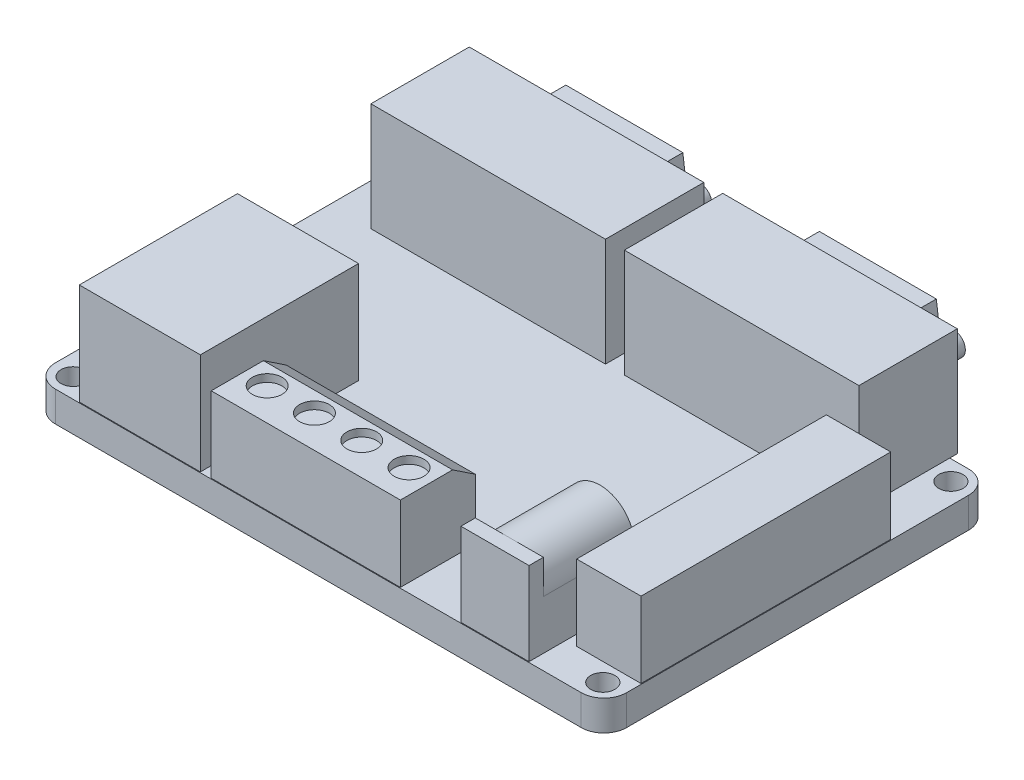
from build123d import *

# Parameters (mm, degrees)
SKETCH_1_W          = 75.5
SKETCH_1_H          = 51.2
EXTRUDE_1_DEPTH     = 4
HOLE_WIZARD_M3_1_D  = 3.2
FILLET_1_R          = 3
SKETCH_4_W          = 9
SKETCH_4_H          = 11
EXTRUDE_2_DEPTH     = 14
CUT_EXTRUDE_1_DEPTH = 12
SKETCH_6_W          = 25
SKETCH_6_H          = 10
EXTRUDE_3_DEPTH     = 10
SKETCH_7_R          = 1.963016799
CUT_EXTRUDE_2_DEPTH = 1
CHAMFER_1_SIZE      = 2
CHAMFER_1_SIZE2     = 3
SKETCH_8_W          = 8.6
SKETCH_8_H          = 33
EXTRUDE_4_DEPTH     = 10
SKETCH_9_W          = 31
SKETCH_9_H          = 18
EXTRUDE_5_DEPTH     = 14.3
SKETCH_10_W         = 31
SKETCH_10_H         = 14.3
SKETCH_10_R         = 1.542197262
CUT_EXTRUDE_3_DEPTH = 5
SKETCH_11_W         = 16
SKETCH_11_H         = 21
EXTRUDE_6_DEPTH     = 13.4
SKETCH_12_W         = 59.433168898
SKETCH_12_H         = 13.4
CUT_EXTRUDE_4_DEPTH = 0.1
SKETCH_13_W         = 33
SKETCH_13_H         = 10
CUT_EXTRUDE_5_DEPTH = 0.1


with BuildPart() as part:
    # 草图1 → 凸台-拉伸1 (new body)
    with BuildSketch(Plane(origin=(0, 0, 0), x_dir=(1, 0, 0), z_dir=(0, 1, 0))):
        Rectangle(SKETCH_1_W, SKETCH_1_H)
    extrude(amount=EXTRUDE_1_DEPTH)

    # M3 间隙孔1 (through all)
    with Locations(Plane(origin=(0, 4, 0), x_dir=(1, 0, 0), z_dir=(0, 1, 0))):
        with Locations((-35, 23), (35, 23), (-35, -23), (35, -23)):
            Hole(HOLE_WIZARD_M3_1_D / 2)

    # 圆角1
    fillet_1_edges = [part.edges().sort_by_distance(p)[0] for p in [
        (-37.75, 2, -25.6),
        (37.75, 2, -25.6),
        (37.75, 2, 25.6),
        (-37.75, 2, 25.6),
    ]]
    fillet(fillet_1_edges, radius=FILLET_1_R)

    # 草图4 → 凸台-拉伸2 (add)
    with BuildSketch(Plane.XY.offset(25.6)):
        with Locations((23.25, 9.5)):
            Rectangle(SKETCH_4_W, SKETCH_4_H)
    extrude(amount=-EXTRUDE_2_DEPTH)

    # 草图5 → 切除-拉伸1 (cut)
    with BuildSketch(Plane(origin=(0, 0, 11.6), x_dir=(-1, 0, 0), z_dir=(0, 0, -1))):
        with BuildLine():
            Line((-27.75, 10.5), (-28.75, 10.5))
            Line((-28.75, 10.5), (-28.75, 16))
            Line((-28.75, 16), (-17.75, 16))
            Line((-17.75, 16), (-17.75, 10.5))
            Line((-17.75, 10.5), (-18.75, 10.5))
            ThreePointArc((-18.75, 10.5), (-23.25, 15), (-27.75, 10.5))
        make_face()
    extrude(amount=-CUT_EXTRUDE_1_DEPTH, mode=Mode.SUBTRACT)

    # 草图6 → 凸台-拉伸3 (add)
    with BuildSketch(Plane(origin=(0, 4, 0), x_dir=(1, 0, 0), z_dir=(0, 1, 0))):
        with Locations((-1.75, -20.6)):
            Rectangle(SKETCH_6_W, SKETCH_6_H)
    extrude(amount=EXTRUDE_3_DEPTH)

    # 草图7 → 切除-拉伸2 (cut)
    with BuildSketch(Plane(origin=(0, 14, 0), x_dir=(1, 0, 0), z_dir=(0, 1, 0))):
        with Locations(Location((-11.125, -21.230534839, 0), (0, 0, 270))):
            Circle(SKETCH_7_R)
        with Locations(Location((-4.875, -21.230534839, 0), (0, 0, 90))):
            Circle(SKETCH_7_R)
        with Locations(Location((7.625, -21.230534839, 0), (0, 0, 90))):
            Circle(SKETCH_7_R)
        with Locations(Location((1.375, -21.230534839, 0), (0, 0, 270))):
            Circle(SKETCH_7_R)
    extrude(amount=-CUT_EXTRUDE_2_DEPTH, mode=Mode.SUBTRACT)

    # 倒角1
    chamfer_1_edges = [part.edges().sort_by_distance(p)[0] for p in [
        (-1.75, 14, 15.6),
    ]]
    chamfer_1_side = [part.faces().sort_by_distance(p)[0] for p in [
        (-1.75, 9, 15.6),
    ]]
    chamfer(chamfer_1_edges, length=CHAMFER_1_SIZE, length2=CHAMFER_1_SIZE2, reference=chamfer_1_side[0])

    # 草图8 → 凸台-拉伸4 (add)
    with BuildSketch(Plane(origin=(0, 4, 0), x_dir=(1, 0, 0), z_dir=(0, 1, 0))):
        with Locations((33.45, -4.1)):
            Rectangle(SKETCH_8_W, SKETCH_8_H)
    extrude(amount=EXTRUDE_4_DEPTH)

    # 草图9 → 凸台-拉伸5 (add)
    with BuildSketch(Plane(origin=(0, 4, 0), x_dir=(1, 0, 0), z_dir=(0, 1, 0))):
        with Locations((-16.75, 22.6)):
            Rectangle(SKETCH_9_W, SKETCH_9_H)
        with Locations((16.75, 22.6)):
            Rectangle(SKETCH_9_W, SKETCH_9_H)
    extrude(amount=EXTRUDE_5_DEPTH)

    # 草图10 → 切除-拉伸3 (cut)
    # profile 1 of 2: a face of its own
    with BuildSketch(Plane(origin=(0, 0, -31.6), x_dir=(-1, 0, 0), z_dir=(0, 0, -1))):
        with Locations((-16.75, 11.15)):
            Rectangle(SKETCH_10_W, SKETCH_10_H)
        with Locations((-26.769914648, 11.409080509)):
            Circle(SKETCH_10_R, mode=Mode.SUBTRACT)
        with Locations((-6.730085352, 11.409080509)):
            Circle(SKETCH_10_R, mode=Mode.SUBTRACT)
        Polygon((-25.404607637, 8.177619476), (-8.095392363, 8.177619476), (-9.020301502, 15.325154661), (-24.479698498, 15.325154661), align=None, mode=Mode.SUBTRACT)
    # profile 2 of 2: a face of its own
    with BuildSketch(Plane(origin=(0, 0, -31.6), x_dir=(-1, 0, 0), z_dir=(0, 0, -1))):
        with Locations((16.75, 11.15)):
            Rectangle(SKETCH_10_W, SKETCH_10_H)
        with Locations((6.730085352, 11.409080509)):
            Circle(SKETCH_10_R, mode=Mode.SUBTRACT)
        with Locations((26.769914648, 11.409080509)):
            Circle(SKETCH_10_R, mode=Mode.SUBTRACT)
        Polygon((9.020301502, 15.325154661), (8.095392363, 8.177619476), (25.404607637, 8.177619476), (24.479698498, 15.325154661), align=None, mode=Mode.SUBTRACT)
    extrude(amount=-CUT_EXTRUDE_3_DEPTH, mode=Mode.SUBTRACT)

    # 草图11 → 凸台-拉伸6 (add)
    with BuildSketch(Plane(origin=(0, 4, 0), x_dir=(1, 0, 0), z_dir=(0, 1, 0))):
        with Locations((-23.683168898, -15.1)):
            Rectangle(SKETCH_11_W, SKETCH_11_H)
    extrude(amount=EXTRUDE_6_DEPTH)

    # 草图12 → 切除-拉伸4 (cut)
    with BuildSketch(Plane.XY.offset(25.6)):
        with Locations((-1.966584449, 10.7)):
            Rectangle(SKETCH_12_W, SKETCH_12_H)
    extrude(amount=-CUT_EXTRUDE_4_DEPTH, mode=Mode.SUBTRACT)

    # 草图13 → 切除-拉伸5 (cut)
    with BuildSketch(Plane(origin=(37.75, 0, 0), x_dir=(0, 0, -1), z_dir=(1, 0, 0))):
        with Locations((-4.1, 9)):
            Rectangle(SKETCH_13_W, SKETCH_13_H)
    extrude(amount=-CUT_EXTRUDE_5_DEPTH, mode=Mode.SUBTRACT)


solid = part.part
